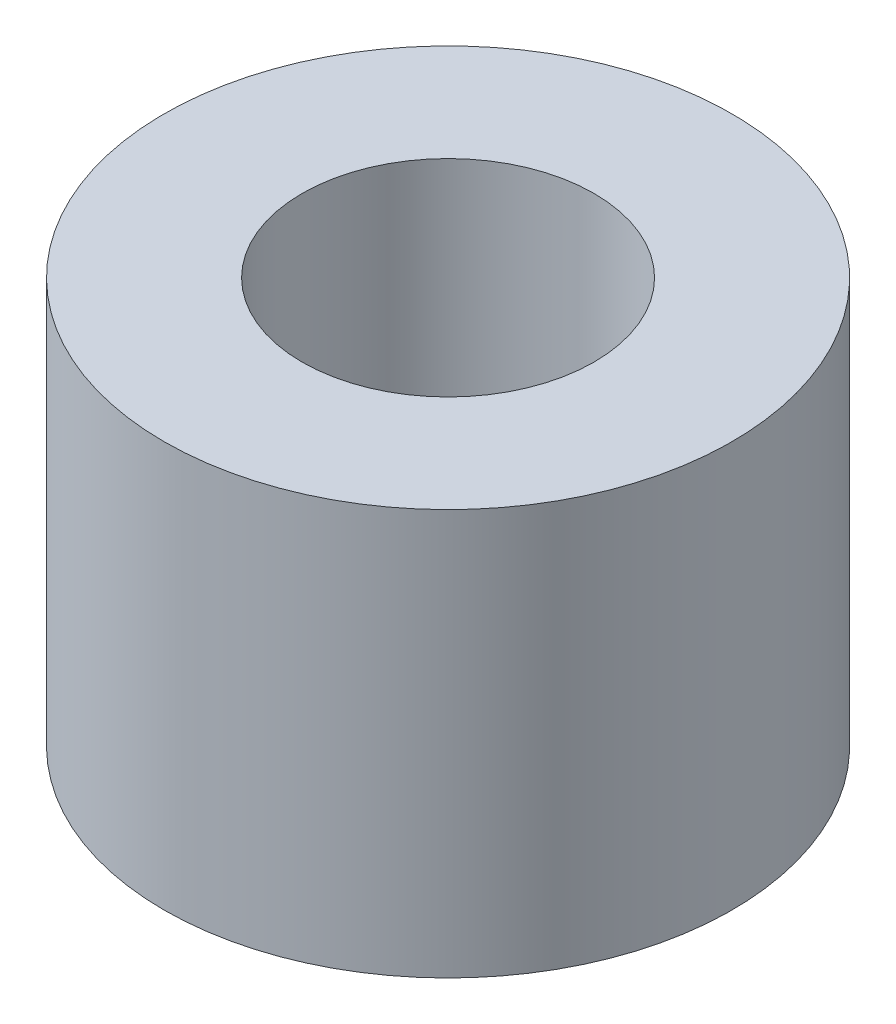
from build123d import *

# Parameters (mm, degrees)
SKETCH1_R           = 3.5
SKETCH1_R_2         = 1.8
BOSS_EXTRUDE1_DEPTH = 5


with BuildPart() as part:
    # Sketch1 → Boss-Extrude1 (new body)
    with BuildSketch(Plane(origin=(0, 0, 0), x_dir=(1, 0, 0), z_dir=(0, 1, 0))):
        with Locations(Location((0, 0, 0), (0, 0, 270))):
            Circle(SKETCH1_R)
        with Locations(Location((0, 0, 0), (0, 0, 270))):
            Circle(SKETCH1_R_2, mode=Mode.SUBTRACT)
    extrude(amount=BOSS_EXTRUDE1_DEPTH)


solid = part.part
